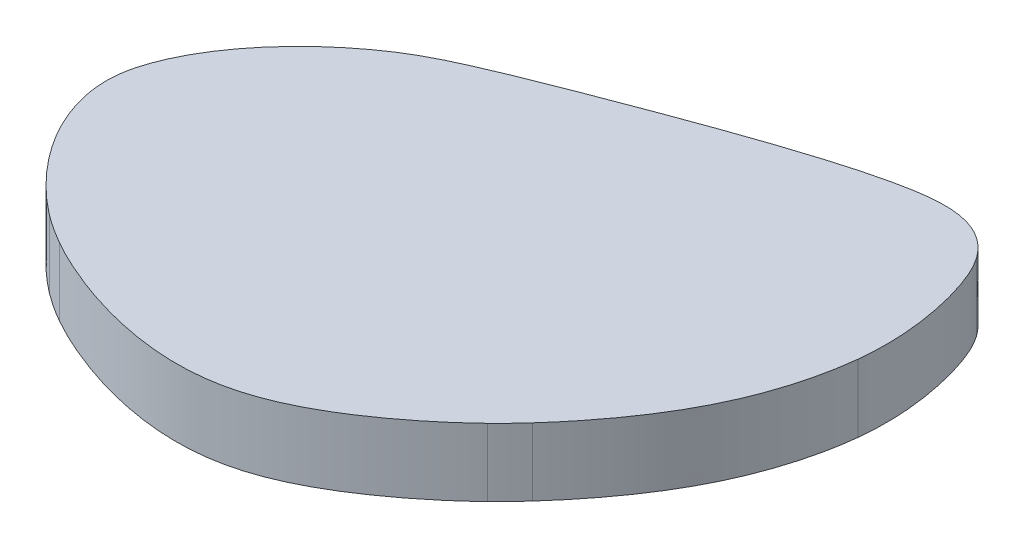
from build123d import *

# Parameters (mm, degrees)
BOSS_EXTRUDE1_DEPTH = 3


with BuildPart() as part:
    # Sketch1 → Boss-Extrude1 (new body)
    with BuildSketch(Plane(origin=(0, 0, 0), x_dir=(1, 0, 0), z_dir=(0, 1, 0))):
        with BuildLine():
            add(Edge.make_bspline(
                [(3.511635356, 10.081993119), (2.683777353, 9.804613769), (1.863835552, 9.515160329), (0.230253693, 8.923789795), (-0.583224169, 8.621607026), (-2.206396034, 8.008419395), (-3.016273743, 7.697632699), (-4.628962954, 7.062163318), (-5.432747453, 6.738927399), (-6.217926269, 6.389737786)],
                knots=[0, 0, 0, 0, 0.25, 0.25, 0.5, 0.5, 0.75, 0.75, 1, 1, 1, 1], degree=3))
            add(Edge.make_bspline(
                [(-6.217926269, 6.389737786), (-6.732382818, 6.160945466), (-7.234463683, 5.921622924), (-8.183546206, 5.395455991), (-8.62655194, 5.105271334), (-9.048790314, 4.793117258)],
                knots=[0, 0, 0, 0, 0.5, 0.5, 1, 1, 1, 1], degree=3))
            add(Edge.make_bspline(
                [(-9.048790314, 4.793117258), (-9.572593815, 4.405877707), (-10.062014593, 3.992496155), (-10.976896057, 3.118992822), (-11.403271889, 2.656862502), (-12.180538449, 1.681198167), (-12.530629341, 1.166730201), (-12.980065384, 0.35150706), (-13.116293965, 0.073646384), (-13.355224075, -0.496551983), (-13.458532141, -0.788753111), (-13.537102217, -1.090483077)],
                knots=[0, 0, 0, 0, 0.25, 0.25, 0.5, 0.5, 0.75, 0.75, 0.875, 0.875, 1, 1, 1, 1], degree=3))
            add(Edge.make_bspline(
                [(-13.537102217, -1.090483077), (-13.604503338, -1.349321289), (-13.653312348, -1.610669429), (-13.698633086, -2.138427716), (-13.694766801, -2.404844782), (-13.669095991, -2.674304123)],
                knots=[0, 0, 0, 0, 0.5, 0.5, 1, 1, 1, 1], degree=3))
            add(Edge.make_bspline(
                [(-13.669095991, -2.674304123), (-13.614722473, -3.245047791), (-13.465072102, -3.801947796), (-13.132326792, -4.625182726), (-13.002771048, -4.897314181), (-12.716708149, -5.424764734), (-12.559270118, -5.681752652), (-12.048709516, -6.434729828), (-11.658142434, -6.914875797), (-10.790086717, -7.825956127), (-10.322161831, -8.25214747), (-9.812779765, -8.638425305)],
                knots=[0, 0, 0, 0, 0.25, 0.25, 0.375, 0.375, 0.5, 0.5, 0.75, 0.75, 1, 1, 1, 1], degree=3))
            add(Edge.make_bspline(
                [(-9.812779765, -8.638425305), (-9.403436257, -8.948841266), (-8.971187665, -9.228098087), (-8.521937596, -9.483933618)],
                knots=[0, 0, 0, 0, 1, 1, 1, 1], degree=3))
            add(Edge.make_bspline(
                [(-8.521937596, -9.483933618), (-7.864056683, -9.858578664), (-7.181432561, -10.171414143), (-5.786386578, -10.721708644), (-5.071855435, -10.953537662), (-3.605278886, -11.316866624), (-2.849475349, -11.447578253), (-1.718218003, -11.531823729), (-1.340241234, -11.541547656), (-0.582297463, -11.517303504), (-0.199738299, -11.482752797), (0.923581709, -11.304498414), (1.643632235, -11.086301788), (2.690757822, -10.644758444), (3.034652799, -10.478281819), (3.700624052, -10.1217784), (4.024775954, -9.931071044), (4.9771204, -9.330350355), (5.585407915, -8.892027633), (6.764007092, -7.960126091), (7.334081995, -7.466250249), (7.879483115, -6.936069456)],
                knots=[0, 0, 0, 0, 0.125, 0.125, 0.25, 0.25, 0.375, 0.375, 0.4375, 0.4375, 0.5, 0.5, 0.625, 0.625, 0.6875, 0.6875, 0.75, 0.75, 0.875, 0.875, 1, 1, 1, 1], degree=3))
            add(Edge.make_bspline(
                [(7.879483115, -6.936069456), (8.216997631, -6.607973846), (8.542463761, -6.268065171), (8.858866967, -5.919188104)],
                knots=[0, 0, 0, 0, 1, 1, 1, 1], degree=3))
            add(Edge.make_bspline(
                [(8.858866967, -5.919188104), (9.175012004, -5.570595703), (9.477806426, -5.211744494), (10.065358345, -4.480382001), (10.350112437, -4.107864538), (10.894645503, -3.343868548), (11.154524274, -2.95218338), (11.640475107, -2.160093023), (11.86731411, -1.758315326), (12.283393308, -0.941720152), (12.472234213, -0.526728057), (12.810730036, 0.315954522), (12.961448028, 0.745894364), (13.350899666, 2.034345662), (13.527929446, 2.882543311), (13.617402736, 3.714282252)],
                knots=[0, 0, 0, 0, 0.125, 0.125, 0.25, 0.25, 0.375, 0.375, 0.5, 0.5, 0.625, 0.625, 0.75, 0.75, 1, 1, 1, 1], degree=3))
            add(Edge.make_bspline(
                [(13.617402736, 3.714282252), (13.691377316, 4.401946011), (13.698633086, 5.056078913), (13.616829268, 6.299524933), (13.529384348, 6.890998409), (13.357643315, 7.712563059), (13.293580729, 7.976485389), (13.151674811, 8.484965664), (13.073696018, 8.729711039), (12.81899484, 9.428553754), (12.624897402, 9.850930849), (12.364040978, 10.220238878)],
                knots=[0, 0, 0, 0, 0.25, 0.25, 0.5, 0.5, 0.625, 0.625, 0.75, 0.75, 1, 1, 1, 1], degree=3))
            add(Edge.make_bspline(
                [(12.364040978, 10.220238878), (12.222991155, 10.419930461), (12.064234022, 10.600326934), (11.702300167, 10.922147541), (11.501210244, 11.064568755), (11.03340954, 11.304299052), (10.763913917, 11.40229064), (10.299063941, 11.495570799), (10.132497423, 11.517663617), (9.782710311, 11.540541943), (9.598386895, 11.541547656), (9.40449869, 11.532585416)],
                knots=[0, 0, 0, 0, 0.25, 0.25, 0.5, 0.5, 0.75, 0.75, 0.875, 0.875, 1, 1, 1, 1], degree=3))
            add(Edge.make_bspline(
                [(9.40449869, 11.532585416), (9.16948443, 11.521722176), (8.928835043, 11.496870906), (8.439557197, 11.428451446), (8.189863163, 11.384644127), (7.441044897, 11.235508513), (6.942646329, 11.113484883), (5.949151517, 10.846896987), (5.457567258, 10.702786987), (4.480489333, 10.401394029), (3.995062888, 10.243968741), (3.511635356, 10.081993119)],
                knots=[0, 0, 0, 0, 0.125, 0.125, 0.25, 0.25, 0.5, 0.5, 0.75, 0.75, 1, 1, 1, 1], degree=3))
        make_face()
    extrude(amount=BOSS_EXTRUDE1_DEPTH)


solid = part.part
